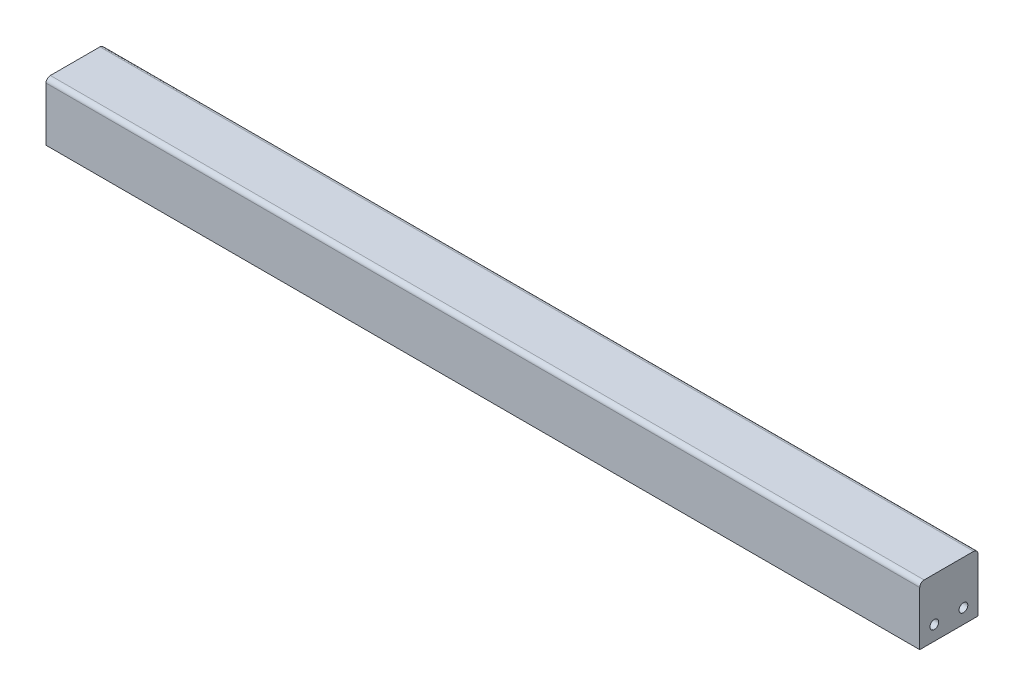
from build123d import *

# Parameters (mm, degrees)
SALIENTE_EXTRUIR1_DEPTH = 300
CROQUIS2_R              = 3
CORTAR_EXTRUIR1_DEPTH   = 10


with BuildPart() as part:
    # Croquis1 → Saliente-Extruir1 (new, symmetric)
    with BuildSketch(Plane(origin=(0, 0, 0), x_dir=(0, 0, -1), z_dir=(1, 0, 0))):
        with BuildLine():
            Line((20, -20), (-20, -20))
            Line((-20, -20), (-20, 17))
            ThreePointArc((-20, 17), (-19.121320344, 19.121320344), (-17, 20))
            Line((-17, 20), (17, 20))
            ThreePointArc((17, 20), (19.121320344, 19.121320344), (20, 17))
            Line((20, 17), (20, -20))
        make_face()
    extrude(amount=SALIENTE_EXTRUIR1_DEPTH, both=True)

    # Croquis2 → Cortar-Extruir1 (cut)
    with BuildSketch(Plane.ZY.offset(300)):
        with Locations((-10, -10)):
            Circle(CROQUIS2_R)
        with Locations((10, -10)):
            Circle(CROQUIS2_R)
    cortar_extruir1 = extrude(amount=-CORTAR_EXTRUIR1_DEPTH, mode=Mode.SUBTRACT)

    # Simetría1: Cortar-Extruir1 across plane
    add(cortar_extruir1.mirror(Plane(origin=(0, 0, 0), x_dir=(0, 0, 1), z_dir=(1, 0, 0))), mode=Mode.SUBTRACT)


solid = part.part
